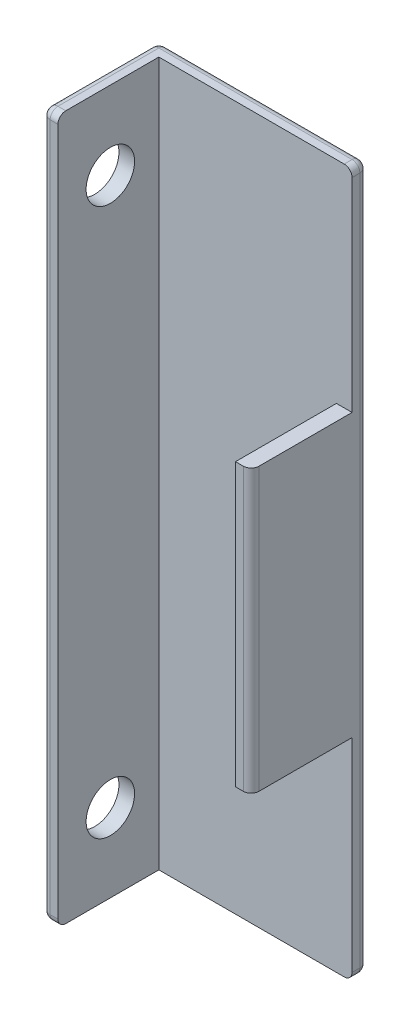
from build123d import *

# Parameters (mm, degrees)
SKETCH1_W           = 26.7
SKETCH1_H           = 90
BOSS_EXTRUDE1_DEPTH = 2
SKETCH2_W           = 2
SKETCH2_H           = 90
BOSS_EXTRUDE2_DEPTH = 12.9
SKETCH3_R           = 3.1
CUT_EXTRUDE1_DEPTH  = 96.052090982
FILLET1_R           = 1
FILLET2_R           = 1
FILLET3_R           = 1
FILLET6_R           = 1
FILLET7_R           = 1
FILLET8_R           = 1
CUT_EXTRUDE2_REACH  = 96.51
SKETCH5_W           = 12.9
SKETCH5_H           = 27


with BuildPart() as part:
    # Sketch1 → Boss-Extrude1 (new body)
    with BuildSketch(Plane.XY):
        with Locations((13.35, 45)):
            Rectangle(SKETCH1_W, SKETCH1_H)
    extrude(amount=BOSS_EXTRUDE1_DEPTH)

    # Sketch2 → Boss-Extrude2 (add)
    with BuildSketch(Plane.XY.offset(2)):
        with Locations((1, 45)):
            Rectangle(SKETCH2_W, SKETCH2_H)
        with Locations((25.7, 45)):
            Rectangle(SKETCH2_W, SKETCH2_H)
    extrude(amount=BOSS_EXTRUDE2_DEPTH)

    # Sketch3 → Cut-Extrude1 (cut, through all)
    with BuildSketch(Plane.ZY):
        with Locations((8.2, 10)):
            Circle(SKETCH3_R)
    cut_extrude1 = extrude(amount=-CUT_EXTRUDE1_DEPTH, mode=Mode.SUBTRACT)

    # Mirror1: Cut-Extrude1 across plane
    add(cut_extrude1.mirror(Plane.ZX.offset(45)), mode=Mode.SUBTRACT)

    # Fillet1
    fillet1_edges = [part.edges().sort_by_distance(p)[0] for p in [
        (13.35, 90, 0),
    ]]
    fillet(fillet1_edges, radius=FILLET1_R)

    # Fillet2
    fillet2_edges = [part.edges().sort_by_distance(p)[0] for p in [
        (0, 44.5, 0),
        (0, 89.707106781, 0.292893219),
        (0, 90, 7.95),
    ]]
    fillet(fillet2_edges, radius=FILLET2_R)

    # Fillet3
    fillet3_edges = [part.edges().sort_by_distance(p)[0] for p in [
        (26.7, 44.5, 0),
        (26.7, 89.707106781, 0.292893219),
        (26.7, 90, 7.95),
    ]]
    fillet(fillet3_edges, radius=FILLET3_R)

    # Fillet6
    fillet6_edges = [part.edges().sort_by_distance(p)[0] for p in [
        (13.35, 0, 0),
        (0.292893219, 0, 0.292893219),
        (26.7, 0, 7.95),
        (0, 0, 7.95),
        (26.407106781, 0, 0.292893219),
    ]]
    fillet(fillet6_edges, radius=FILLET6_R)

    # Fillet7
    fillet7_edges = [part.edges().sort_by_distance(p)[0] for p in [
        (1.5, 90, 14.9),
        (0, 45, 14.9),
        (0.292893219, 89.707106781, 14.9),
        (1.5, 0, 14.9),
        (0.292893219, 0.292893219, 14.9),
    ]]
    fillet(fillet7_edges, radius=FILLET7_R)

    # Fillet8
    fillet8_edges = [part.edges().sort_by_distance(p)[0] for p in [
        (25.2, 0, 14.9),
        (25.2, 90, 14.9),
        (26.407106781, 89.707106781, 14.9),
        (26.7, 45, 14.9),
        (26.407106781, 0.292893219, 14.9),
    ]]
    fillet(fillet8_edges, radius=FILLET8_R)

    # Cut-Extrude2: up to this face of the body (flat: up to its plane)
    cut_extrude2_end = Plane(part.part.faces().sort_by_distance((26.7, 45, 7.407866324))[0])
    # Sketch5 → Cut-Extrude2 (cut, up to the picked face)
    with BuildSketch(Plane.ZY.offset(-24.7), mode=Mode.PRIVATE) as cut_extrude2_sk1:
        with Locations((8.45, 76.5)):
            Rectangle(SKETCH5_W, SKETCH5_H)
    cut_extrude2_tool1 = split(extrude(cut_extrude2_sk1.sketch, amount=-CUT_EXTRUDE2_REACH, mode=Mode.PRIVATE), bisect_by=cut_extrude2_end, keep=Keep.BOTH, mode=Mode.PRIVATE)
    # Sketch5 → Cut-Extrude2 (cut, up to the picked face)
    with BuildSketch(Plane.ZY.offset(-24.7), mode=Mode.PRIVATE) as cut_extrude2_sk2:
        with Locations((8.45, 13.5)):
            Rectangle(SKETCH5_W, SKETCH5_H)
    cut_extrude2_tool2 = split(extrude(cut_extrude2_sk2.sketch, amount=-CUT_EXTRUDE2_REACH, mode=Mode.PRIVATE), bisect_by=cut_extrude2_end, keep=Keep.BOTH, mode=Mode.PRIVATE)
    add(cut_extrude2_tool1.solids().sort_by(Axis((24.7, 76.5, 8.45), (1, 0, 0)))[0], mode=Mode.SUBTRACT)
    add(cut_extrude2_tool2.solids().sort_by(Axis((24.7, 13.5, 8.45), (1, 0, 0)))[0], mode=Mode.SUBTRACT)


solid = part.part
